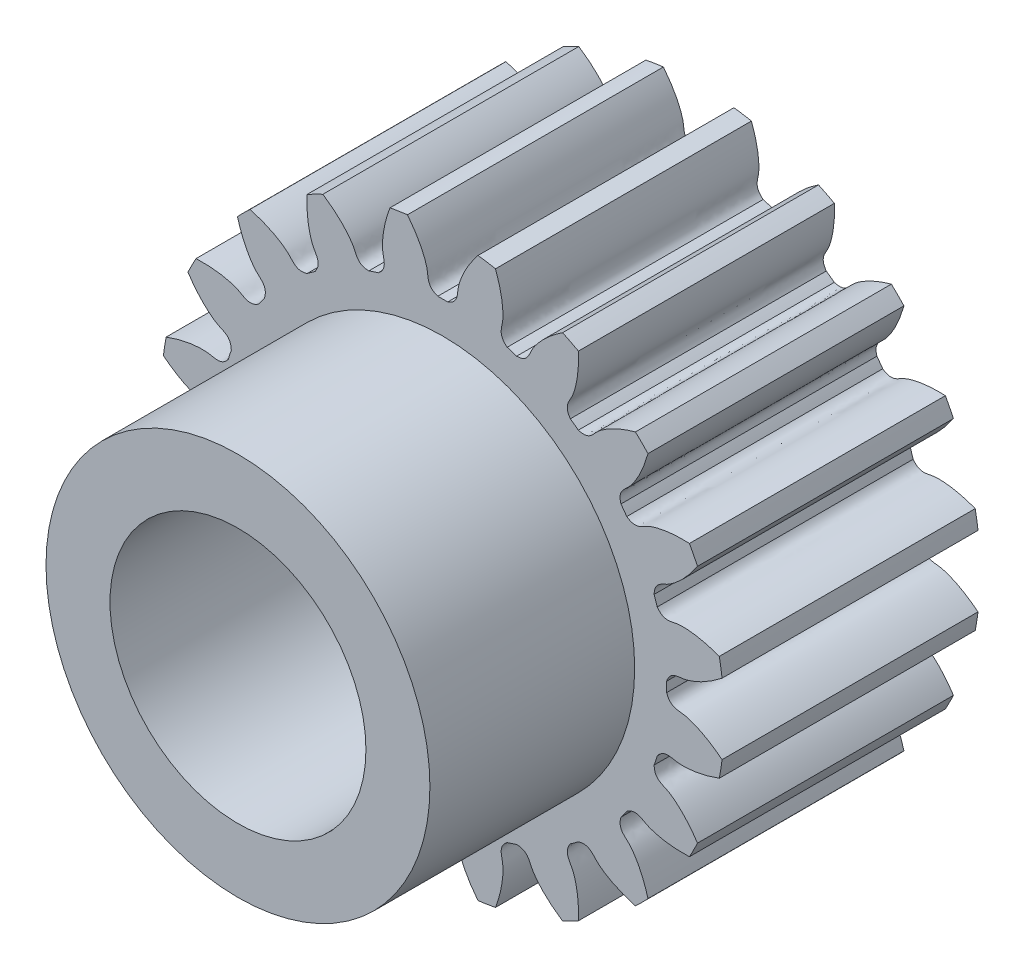
from build123d import *

# Parameters (mm, degrees)
SKETCH_1_R               = 11
EXTRUDE_1_DEPTH          = 10
CUT_EXTRUDE_1_DEPTH      = 19.493242009
PATTERN_CIRCULAR_1_COUNT = 20
SKETCH_4_R               = 7.5
EXTRUDE_2_DEPTH          = 8
SKETCH_5_R               = 5
CUT_EXTRUDE_2_DEPTH      = 38


with BuildPart() as part:
    # 草图1 → 凸台-拉伸1 (new body)
    with BuildSketch(Plane.XY):
        Circle(SKETCH_1_R)
    extrude(amount=EXTRUDE_1_DEPTH)

    # 草图2 → 切除-拉伸1 (cut, through all)
    with BuildSketch(Plane.XY):
        with BuildLine():
            ThreePointArc((0.1933166, 8.747864236), (0, 8.75), (-0.1933166, 8.747864236))
            add(Edge.make_bspline(
                [(-0.1933166, 8.747864236), (-0.611189405, 8.893475512), (-0.557084099, 9.187113699), (-0.612897056, 9.470009403), (-0.618892186, 9.497556614), (-0.62631089, 9.528634615), (-0.635292097, 9.563196836), (-0.64597914, 9.601191497), (-0.658512055, 9.642562828), (-0.673029871, 9.687250733), (-0.68966975, 9.735190947), (-0.7085671, 9.786315045), (-0.729855399, 9.840550501), (-0.753666102, 9.897820731), (-0.780128531, 9.958045151), (-0.809369765, 10.021139231), (-0.841514533, 10.087014551), (-0.876685117, 10.155578861), (-0.915001238, 10.22673615), (-0.956579966, 10.300386704), (-1.001535609, 10.376427181), (-1.049979626, 10.454750678), (-1.102020521, 10.535246805), (-1.157763756, 10.617801764), (-1.217311651, 10.70229842), (-1.280763301, 10.78861639), (-1.34821448, 10.876632121), (-1.419757562, 10.966218973), (-1.495481426, 11.057247311), (-1.575471385, 11.149584594), (-1.659809097, 11.243095463), (-1.748572489, 11.337641835), (-1.841835684, 11.433083002), (-1.939668926, 11.529275727), (-2.042138506, 11.626074339), (-2.149306698, 11.723330842), (-2.261231689, 11.820895011), (-2.377967518, 11.918614499), (-2.499564012, 12.016334946), (-2.626066734, 12.113900082), (-2.757516899, 12.21115184), (-2.941473591, 12.341639868), (-3.083932413, 12.436332601), (-3.181157982, 12.49825186)],
                knots=[0, 0, 0, 0, 0.165916003, 0.170905922, 0.176663519, 0.183188797, 0.190481754, 0.198542391, 0.207370708, 0.216966704, 0.22733038, 0.238461736, 0.250360771, 0.263027487, 0.276461881, 0.290663956, 0.30563371, 0.321371144, 0.337876258, 0.355149051, 0.373189524, 0.391997677, 0.411573509, 0.431917021, 0.453028213, 0.474907084, 0.497553636, 0.520967867, 0.545149777, 0.570099367, 0.595816637, 0.622301587, 0.649554216, 0.677574526, 0.706362514, 0.735918183, 0.766241531, 0.797332559, 0.829191267, 0.861817654, 0.895211721, 0.929373468, 1, 1, 1, 1], degree=3))
            ThreePointArc((-3.181157982, 12.49825186), (0, 12.89674632), (3.181157982, 12.49825186))
            add(Edge.make_bspline(
                [(0.1933166, 8.747864236), (0.611189405, 8.893475512), (0.557084099, 9.187113699), (0.612897056, 9.470009403), (0.618892186, 9.497556614), (0.62631089, 9.528634615), (0.635292097, 9.563196836), (0.64597914, 9.601191497), (0.658512055, 9.642562828), (0.673029871, 9.687250733), (0.68966975, 9.735190947), (0.7085671, 9.786315045), (0.729855399, 9.840550501), (0.753666102, 9.897820731), (0.780128531, 9.958045151), (0.809369765, 10.021139231), (0.841514533, 10.087014551), (0.876685117, 10.155578861), (0.915001238, 10.22673615), (0.956579966, 10.300386704), (1.001535609, 10.376427181), (1.049979626, 10.454750678), (1.102020521, 10.535246805), (1.157763756, 10.617801764), (1.217311651, 10.70229842), (1.280763301, 10.78861639), (1.34821448, 10.876632121), (1.419757562, 10.966218973), (1.495481426, 11.057247311), (1.575471385, 11.149584594), (1.659809097, 11.243095463), (1.748572489, 11.337641835), (1.841835684, 11.433083002), (1.939668926, 11.529275727), (2.042138506, 11.626074339), (2.149306698, 11.723330842), (2.261231689, 11.820895011), (2.377967518, 11.918614499), (2.499564012, 12.016334946), (2.626066734, 12.113900082), (2.757516899, 12.21115184), (2.941473591, 12.341639868), (3.083932413, 12.436332601), (3.181157982, 12.49825186)],
                knots=[0, 0, 0, 0, 0.165916003, 0.170905922, 0.176663519, 0.183188797, 0.190481754, 0.198542391, 0.207370708, 0.216966704, 0.22733038, 0.238461736, 0.250360771, 0.263027487, 0.276461881, 0.290663956, 0.30563371, 0.321371144, 0.337876258, 0.355149051, 0.373189524, 0.391997677, 0.411573509, 0.431917021, 0.453028213, 0.474907084, 0.497553636, 0.520967867, 0.545149777, 0.570099367, 0.595816637, 0.622301587, 0.649554216, 0.677574526, 0.706362514, 0.735918183, 0.766241531, 0.797332559, 0.829191267, 0.861817654, 0.895211721, 0.929373468, 1, 1, 1, 1], degree=3))
        make_face()
    cut_extrude_1 = extrude(amount=CUT_EXTRUDE_1_DEPTH, mode=Mode.SUBTRACT)

    # 阵列(圆周)1: 切除-拉伸1 ×20 about axis
    pattern_circular_1_axis = Axis((0, 0, -1.5), (0, 0, 1))
    for i in range(1, PATTERN_CIRCULAR_1_COUNT):
        add(cut_extrude_1.rotate(pattern_circular_1_axis, i * 360 / PATTERN_CIRCULAR_1_COUNT), mode=Mode.SUBTRACT)

    # 草图4 → 凸台-拉伸2 (add)
    with BuildSketch(Plane.XY.offset(10)):
        Circle(SKETCH_4_R)
    extrude(amount=EXTRUDE_2_DEPTH)

    # 草图5 → 切除-拉伸2 (cut)
    with BuildSketch(Plane.XY.offset(18)):
        Circle(SKETCH_5_R)
    extrude(amount=-CUT_EXTRUDE_2_DEPTH, mode=Mode.SUBTRACT)


solid = part.part
